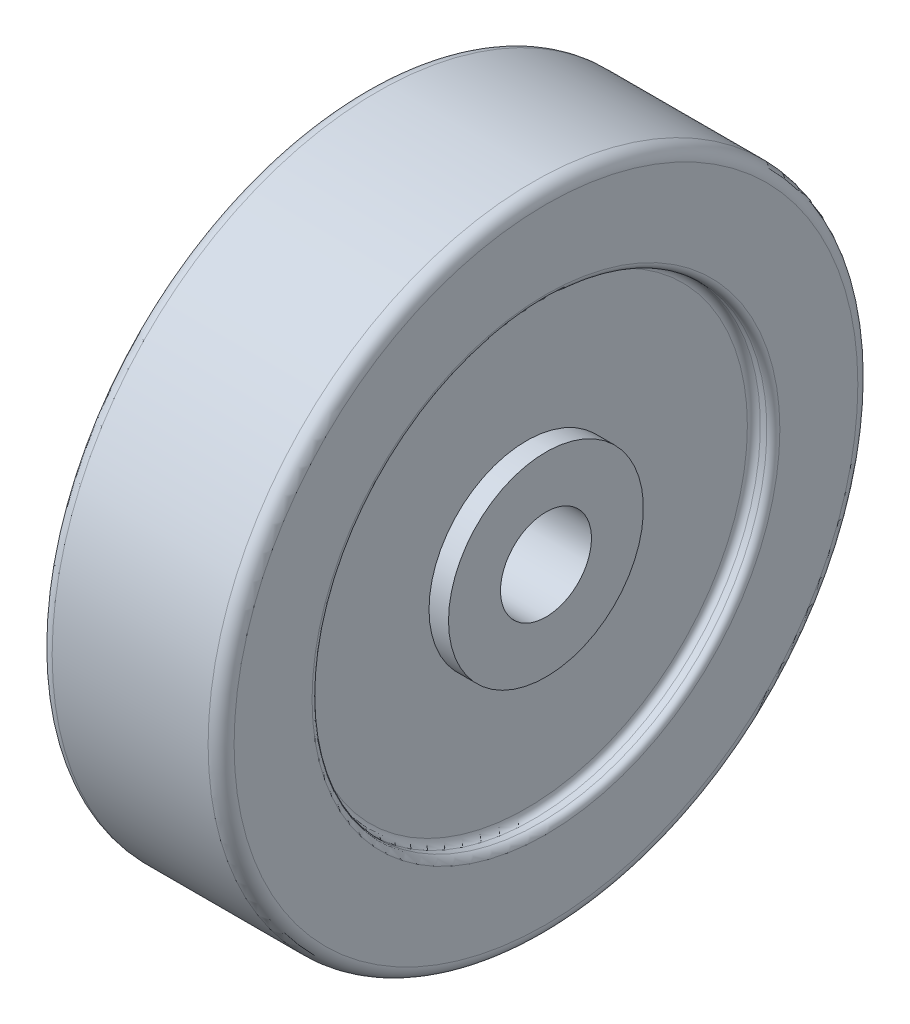
from build123d import *

# Parameters (mm, degrees)
REDONDEO1_R = 2
REDONDEO2_R = 1


with BuildPart() as part:
    # Croquis1 → Revolución1 (revolve)
    with BuildSketch(Plane.XY, mode=Mode.PRIVATE) as revoluci_n1_sk:
        Polygon((0, 7), (28, 7), (28, 15), (25, 15), (25, 35), (28, 35), (28, 50), (0, 50), (0, 35), (3, 35), (3, 15), (0, 15), align=None)
    revolve(revoluci_n1_sk.sketch.rotate(Axis((-1.552010625, 0, 0), (1, 0, 0)), 90), axis=Axis((-1.552010625, 0, 0), (1, 0, 0)))

    # Redondeo1
    redondeo1_edges = [part.edges().sort_by_distance(p)[0] for p in [
        (0, 0, -50),
        (28, 0, -50),
    ]]
    fillet(redondeo1_edges, radius=REDONDEO1_R)

    # Redondeo2
    redondeo2_edges = [part.edges().sort_by_distance(p)[0] for p in [
        (28, 0, -35),
        (25, 0, -35),
        (3, 0, -35),
        (0, 0, -35),
    ]]
    fillet(redondeo2_edges, radius=REDONDEO2_R)


solid = part.part
